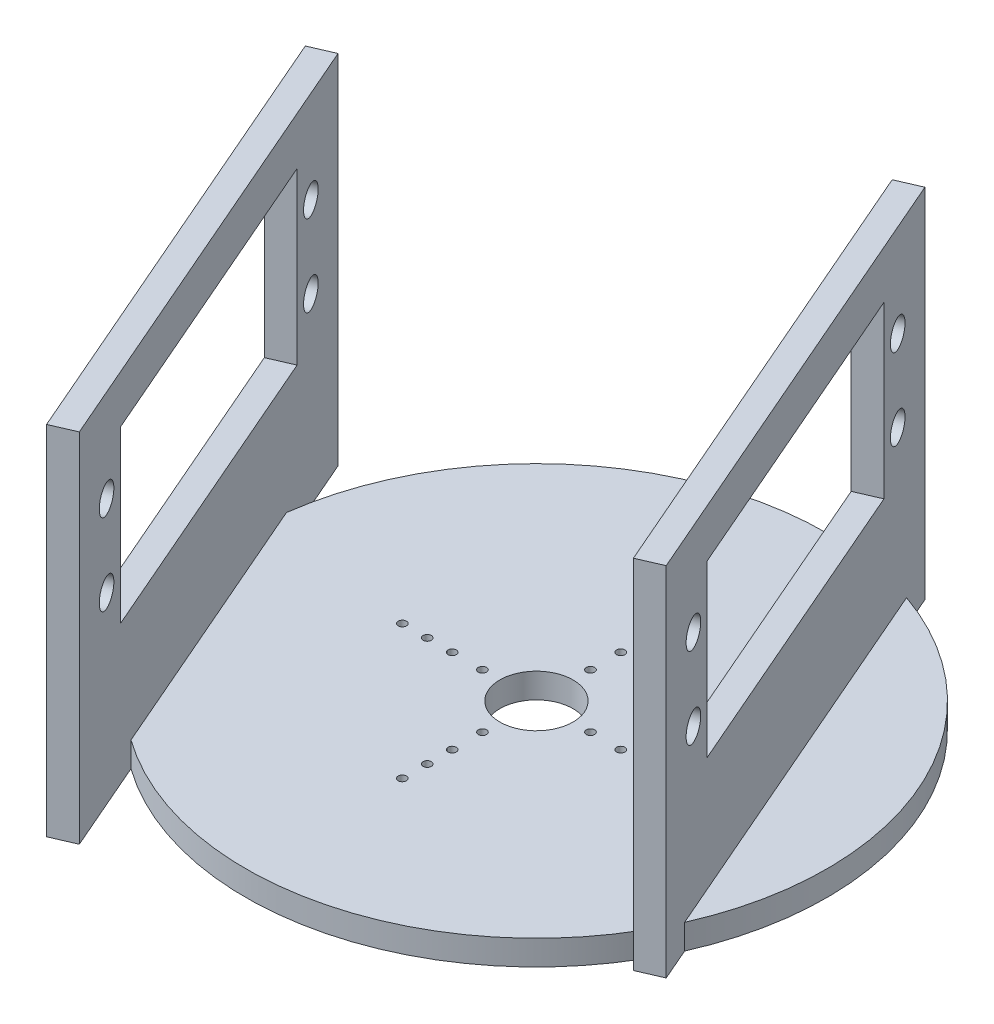
from build123d import *

# Parameters (mm, degrees)
SKETCH1_R           = 0.5
BOSS_EXTRUDE1_DEPTH = 3
BOSS_EXTRUDE2_START = 30
SKETCH2_W           = 60
SKETCH2_H           = 40
SKETCH2_R           = 1.689490446
SKETCH2_W_2         = 41
SKETCH2_H_2         = 20.5
BOSS_EXTRUDE2_DEPTH = 3
BOSS_EXTRUDE3_START = -23.72
SKETCH2_2_W         = 60
SKETCH2_2_H         = 40
SKETCH2_2_R         = 1.689490446
SKETCH2_2_W_2       = 41
SKETCH2_2_H_2       = 20.5
BOSS_EXTRUDE3_DEPTH = 3
CUT_EXTRUDE1_DEPTH  = 10


with BuildPart() as part:
    # Sketch1 → Boss-Extrude1 (new body)
    with BuildSketch(Plane(origin=(0, 0, 0), x_dir=(1, 0, 0), z_dir=(0, 1, 0))):
        with BuildLine():
            ThreePointArc((7.77744177, 34.124938088), (-19.979563219, 28.73703279), (-34.697157454, 4.594264319))
            Line((-34.697157454, 4.594264319), (-39.463419759, 15.576857865))
            Line((-39.463419759, 15.576857865), (-42.291947314, 14.577141972))
            Line((-42.291947314, 14.577141972), (-34.916382331, -2.417900937))
            ThreePointArc((-34.916382331, -2.417900937), (-32.106828614, -13.933827771), (-25.614551861, -23.85151427))
            Line((-25.614551861, -23.85151427), (-18.322186149, -40.654846416))
            Line((-18.322186149, -40.654846416), (-15.576857865, -39.463419759))
            Line((-15.576857865, -39.463419759), (-20.34312017, -28.480826213))
            ThreePointArc((-20.34312017, -28.480826213), (7.343177958, -34.221013098), (30.237043308, -17.627286007))
            Line((30.237043308, -17.627286007), (30.950523486, -19.271312771))
            Line((30.950523486, -19.271312771), (33.702537367, -18.076984677))
            Line((33.702537367, -18.076984677), (32.005152982, -14.165810341))
            ThreePointArc((32.005152982, -14.165810341), (32.106828614, 13.933827771), (11.51335986, 33.052118612))
            Line((11.51335986, 33.052118612), (9.815975474, 36.963292947))
            Line((9.815975474, 36.963292947), (7.063961593, 35.768964852))
            Line((7.063961593, 35.768964852), (7.77744177, 34.124938088))
        make_face()
        with Locations(Location((0, -16.15, 0), (0, 0, 270))):
            Circle(SKETCH1_R, mode=Mode.SUBTRACT)
        with BuildLine():
            ThreePointArc((0, -12.65), (0.5, -13.15), (0, -13.65))
            ThreePointArc((0, -13.65), (-0.5, -13.15), (0, -12.65))
        make_face(mode=Mode.SUBTRACT)
        with BuildLine():
            ThreePointArc((0, -9.65), (0.5, -10.15), (0, -10.65))
            ThreePointArc((0, -10.65), (-0.5, -10.15), (0, -9.65))
        make_face(mode=Mode.SUBTRACT)
        with BuildLine():
            ThreePointArc((0, -6.005210608), (0.5, -6.505210608), (0, -7.005210608))
            ThreePointArc((0, -7.005210608), (-0.5, -6.505210608), (0, -6.005210608))
        make_face(mode=Mode.SUBTRACT)
        with Locations(Location((-16.15, 0, 0), (0, 0, 270))):
            Circle(SKETCH1_R, mode=Mode.SUBTRACT)
        with BuildLine():
            ThreePointArc((-13.65, 0), (-13.15, 0.5), (-12.65, 0))
            ThreePointArc((-12.65, 0), (-13.15, -0.5), (-13.65, 0))
        make_face(mode=Mode.SUBTRACT)
        with BuildLine():
            ThreePointArc((-10.65, 0), (-10.15, 0.5), (-9.65, 0))
            ThreePointArc((-9.65, 0), (-10.15, -0.5), (-10.65, 0))
        make_face(mode=Mode.SUBTRACT)
        with BuildLine():
            ThreePointArc((-7.005210608, 0), (-6.505210608, 0.5), (-6.005210608, 0))
            ThreePointArc((-6.005210608, 0), (-6.505210608, -0.5), (-7.005210608, 0))
        make_face(mode=Mode.SUBTRACT)
        with BuildLine():
            ThreePointArc((4.401273885, 0), (3.11217061, -3.11217061), (0, -4.401273885))
            ThreePointArc((0, -4.401273885), (-3.11217061, -3.11217061), (-4.401273885, 0))
            ThreePointArc((-4.401273885, 0), (-3.11217061, 3.11217061), (0, 4.401273885))
            Line((0, 4.401273885), (0, 0))
            Line((0, 0), (4.037455609, 1.752188351))
            ThreePointArc((4.037455609, 1.752188351), (4.309359567, 0.894780386), (4.401273885, 0))
        make_face(mode=Mode.SUBTRACT)
        with BuildLine():
            ThreePointArc((7.005210608, 0), (6.505210608, -0.5), (6.005210608, 0))
            ThreePointArc((6.005210608, 0), (6.505210608, 0.5), (7.005210608, 0))
        make_face(mode=Mode.SUBTRACT)
        with BuildLine():
            ThreePointArc((0, 7.005210608), (0.5, 6.505210608), (0, 6.005210608))
            ThreePointArc((0, 6.005210608), (-0.5, 6.505210608), (0, 7.005210608))
        make_face(mode=Mode.SUBTRACT)
        with BuildLine():
            ThreePointArc((10.65, 0), (10.15, -0.5), (9.65, 0))
            ThreePointArc((9.65, 0), (10.15, 0.5), (10.65, 0))
        make_face(mode=Mode.SUBTRACT)
        with BuildLine():
            ThreePointArc((13.65, 0), (13.15, -0.5), (12.65, 0))
            ThreePointArc((12.65, 0), (13.15, 0.5), (13.65, 0))
        make_face(mode=Mode.SUBTRACT)
        with Locations(Location((16.15, 0, 0), (0, 0, 270))):
            Circle(SKETCH1_R, mode=Mode.SUBTRACT)
        with BuildLine():
            ThreePointArc((0, 10.65), (0.5, 10.15), (0, 9.65))
            ThreePointArc((0, 9.65), (-0.5, 10.15), (0, 10.65))
        make_face(mode=Mode.SUBTRACT)
        with BuildLine():
            ThreePointArc((0, 13.65), (0.5, 13.15), (0, 12.65))
            ThreePointArc((0, 12.65), (-0.5, 13.15), (0, 13.65))
        make_face(mode=Mode.SUBTRACT)
        with Locations(Location((0, 16.15, 0), (0, 0, 270))):
            Circle(SKETCH1_R, mode=Mode.SUBTRACT)
    extrude(amount=BOSS_EXTRUDE1_DEPTH)

    # Sketch2 → Boss-Extrude2 (add)
    with BuildSketch(Plane(origin=(0, 0, 0), x_dir=(0.3981093648941227, 0, 0.9173379603960573), z_dir=(-0.9173379603960573, 0, 0.3981093648941227)).offset(BOSS_EXTRUDE2_START)):
        with Locations((0, 23)):
            Rectangle(SKETCH2_W, SKETCH2_H)
        with Locations(Location((-23.689490446, 31.9, 0), (0, 0, 180))):
            Circle(SKETCH2_R, mode=Mode.SUBTRACT)
        with Locations(Location((-23.689490446, 22.1, 0), (0, 0, 180))):
            Circle(SKETCH2_R, mode=Mode.SUBTRACT)
        with Locations(Location((23.689490446, 22.1, 0), (0, 0, 180))):
            Circle(SKETCH2_R, mode=Mode.SUBTRACT)
        with Locations(Location((23.689490446, 31.9, 0), (0, 0, 180))):
            Circle(SKETCH2_R, mode=Mode.SUBTRACT)
        with Locations((0, 27)):
            Rectangle(SKETCH2_W_2, SKETCH2_H_2, mode=Mode.SUBTRACT)
    extrude(amount=BOSS_EXTRUDE2_DEPTH)

    # Sketch2<2> → Boss-Extrude3 (add)
    with BuildSketch(Plane(origin=(0, 0, 0), x_dir=(0.3981093648941227, 0, 0.9173379603960573), z_dir=(-0.9173379603960573, 0, 0.3981093648941227)).offset(BOSS_EXTRUDE3_START)):
        with Locations((0, 23)):
            Rectangle(SKETCH2_2_W, SKETCH2_2_H)
        with Locations(Location((-23.689490446, 31.9, 0), (0, 0, 180))):
            Circle(SKETCH2_2_R, mode=Mode.SUBTRACT)
        with Locations(Location((-23.689490446, 22.1, 0), (0, 0, 180))):
            Circle(SKETCH2_2_R, mode=Mode.SUBTRACT)
        with Locations(Location((23.689490446, 22.1, 0), (0, 0, 180))):
            Circle(SKETCH2_2_R, mode=Mode.SUBTRACT)
        with Locations(Location((23.689490446, 31.9, 0), (0, 0, 180))):
            Circle(SKETCH2_2_R, mode=Mode.SUBTRACT)
        with Locations((0, 27)):
            Rectangle(SKETCH2_2_W_2, SKETCH2_2_H_2, mode=Mode.SUBTRACT)
    extrude(amount=BOSS_EXTRUDE3_DEPTH)

    # Sketch1<3> → Cut-Extrude1 (cut)
    with BuildSketch(Plane(origin=(0, 0, 0), x_dir=(1, 0, 0), z_dir=(0, 1, 0))):
        with BuildLine():
            Line((0, 4.401273885), (0, 0))
            Line((0, 0), (4.037455609, 1.752188351))
            ThreePointArc((4.037455609, 1.752188351), (2.414472094, 3.679882651), (0, 4.401273885))
        make_face()
    extrude(amount=CUT_EXTRUDE1_DEPTH, mode=Mode.SUBTRACT)


solid = part.part
